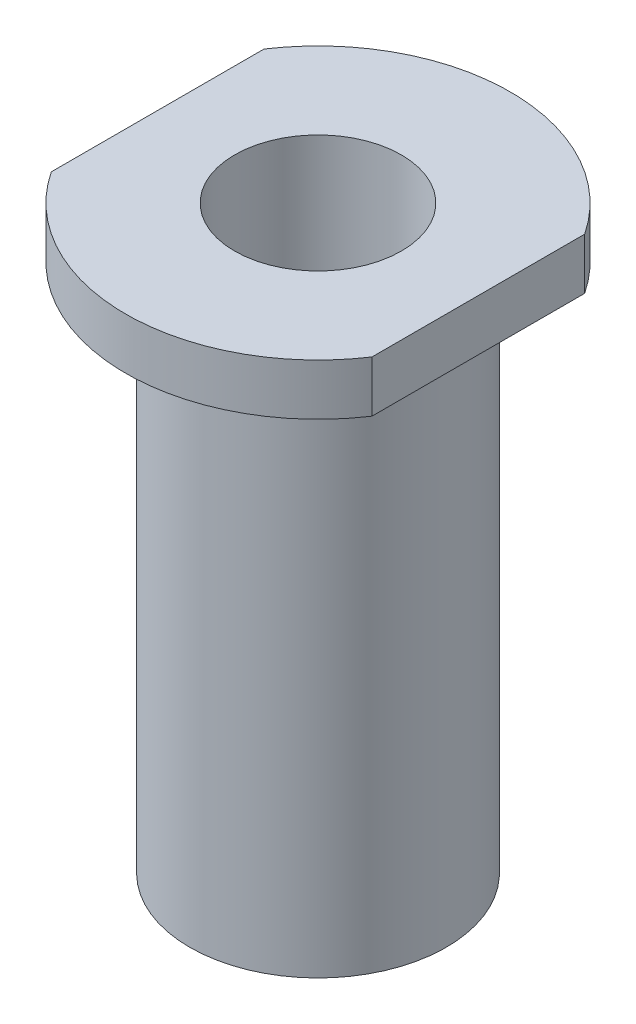
from build123d import *

# Parameters (mm, degrees)
SKETCH1_R           = 5
BOSS_EXTRUDE1_DEPTH = 22.63
SKETCH2_R           = 3.25
CUT_EXTRUDE1_DEPTH  = 9.652
SKETCH3_R           = 2.5
CUT_EXTRUDE2_DEPTH  = 9.978
SKETCH4_R           = 1.5
CUT_EXTRUDE3_DEPTH  = 3
BOSS_EXTRUDE3_START = -2
SKETCH5_R           = 5
BOSS_EXTRUDE3_DEPTH = 2


with BuildPart() as part:
    # Sketch1 → Boss-Extrude1 (new body)
    with BuildSketch(Plane(origin=(0, 0, 0), x_dir=(1, 0, 0), z_dir=(0, 1, 0))):
        with Locations(Location((0, 0, 0), (0, 0, 270))):
            Circle(SKETCH1_R)
    extrude(amount=BOSS_EXTRUDE1_DEPTH)

    # Sketch2 → Cut-Extrude1 (cut)
    with BuildSketch(Plane(origin=(0, 22.63, 0), x_dir=(1, 0, 0), z_dir=(0, 1, 0))):
        with Locations(Location((0, 0, 0), (0, 0, 270))):
            Circle(SKETCH2_R)
    extrude(amount=-CUT_EXTRUDE1_DEPTH, mode=Mode.SUBTRACT)

    # Sketch3 → Cut-Extrude2 (cut)
    with BuildSketch(Plane(origin=(0, 12.978, 0), x_dir=(1, 0, 0), z_dir=(0, 1, 0))):
        with Locations(Location((0, 0, 0), (0, 0, 270))):
            Circle(SKETCH3_R)
    extrude(amount=-CUT_EXTRUDE2_DEPTH, mode=Mode.SUBTRACT)

    # Sketch4 → Cut-Extrude3 (cut)
    with BuildSketch(Plane(origin=(0, 3, 0), x_dir=(1, 0, 0), z_dir=(0, 1, 0))):
        with Locations(Location((0, 0, 0), (0, 0, 270))):
            Circle(SKETCH4_R)
    extrude(amount=-CUT_EXTRUDE3_DEPTH, mode=Mode.SUBTRACT)

    # Sketch5 → Boss-Extrude3 (add)
    with BuildSketch(Plane(origin=(0, 22.63, 0), x_dir=(1, 0, 0), z_dir=(0, 1, 0)).offset(BOSS_EXTRUDE3_START)):
        with BuildLine():
            Line((6.25, -4.145780988), (6.25, 4.145780988))
            ThreePointArc((6.25, 4.145780988), (0, 7.5), (-6.25, 4.145780988))
            Line((-6.25, 4.145780988), (-6.25, -4.145780988))
            ThreePointArc((-6.25, -4.145780988), (0, -7.5), (6.25, -4.145780988))
        make_face()
        with Locations(Location((0, 0, 0), (0, 0, 270))):
            Circle(SKETCH5_R, mode=Mode.SUBTRACT)
    extrude(amount=BOSS_EXTRUDE3_DEPTH)


solid = part.part
